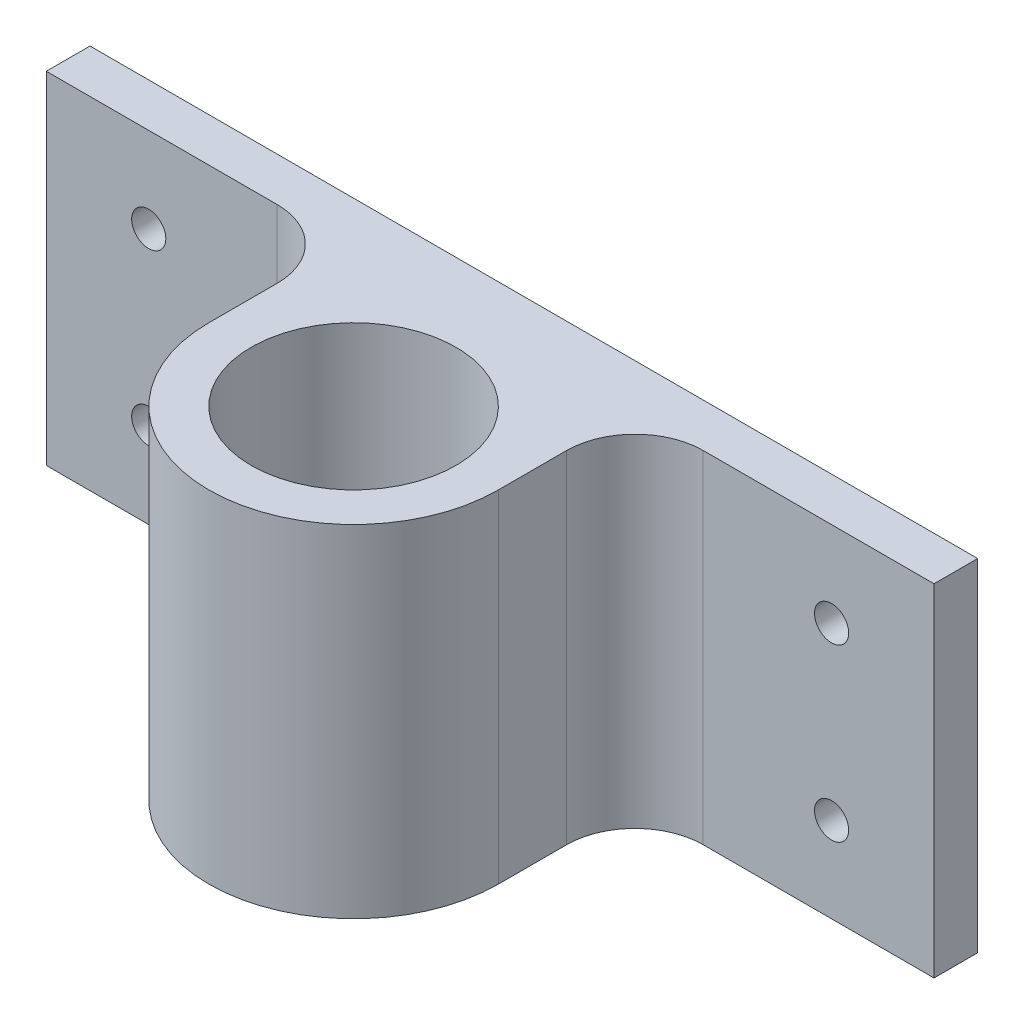
from build123d import *

# Parameters (mm, degrees)
SKETCH1_R           = 75
BOSS_EXTRUDE1_DEPTH = 250
SKETCH2_R           = 12.5
CUT_EXTRUDE1_DEPTH  = 250


with BuildPart() as part:
    # Sketch1 → Boss-Extrude1 (new body)
    with BuildSketch(Plane(origin=(0, 0, 0), x_dir=(1, 0, 0), z_dir=(0, 1, 0))):
        with BuildLine():
            Line((-325, 132), (325, 132))
            Line((325, 132), (325, 100))
            Line((325, 100), (156, 100))
            ThreePointArc((156, 100), (120.644660941, 85.355339059), (106, 50))
            Line((106, 50), (106, 0))
            ThreePointArc((106, 0), (0, -106), (-106, 0))
            Line((-106, 0), (-106, 50))
            ThreePointArc((-106, 50), (-120.644660941, 85.355339059), (-156, 100))
            Line((-156, 100), (-325, 100))
            Line((-325, 100), (-325, 132))
        make_face()
        with Locations(Location((0, 0, 0), (0, 0, 270))):
            Circle(SKETCH1_R, mode=Mode.SUBTRACT)
    extrude(amount=BOSS_EXTRUDE1_DEPTH)

    # Sketch2 → Cut-Extrude1 (cut)
    with BuildSketch(Plane(origin=(0, 0, -132), x_dir=(-1, 0, 0), z_dir=(0, 0, -1))):
        with Locations((-250, 187.5)):
            Circle(SKETCH2_R)
        with Locations((-250, 62.5)):
            Circle(SKETCH2_R)
        with Locations((250, 62.5)):
            Circle(SKETCH2_R)
        with Locations((250, 187.5)):
            Circle(SKETCH2_R)
    extrude(amount=-CUT_EXTRUDE1_DEPTH, mode=Mode.SUBTRACT)


solid = part.part
